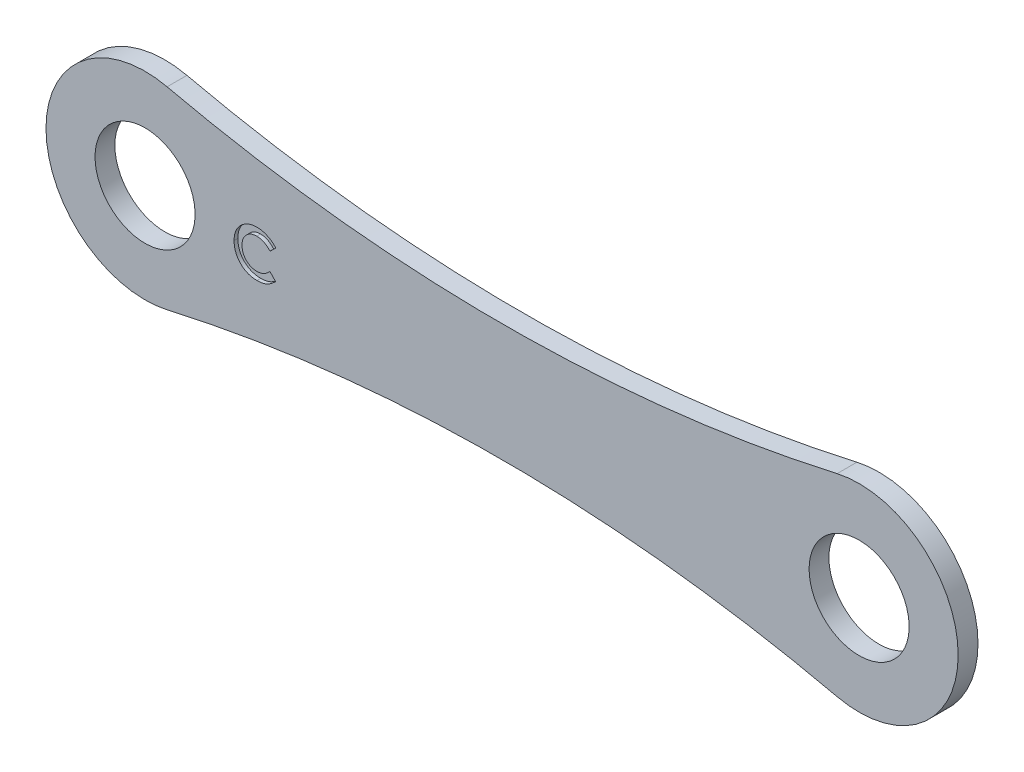
from build123d import *

# Parameters (mm, degrees)
ESQUISSE1_R             = 3.985
BOSS_EXTRU_1_DEPTH      = 1.58
ENL_V_MAT_EXTRU_1_DEPTH = 0.3


with BuildPart() as part:
    # Esquisse1 → Boss.-Extru.1 (new body)
    with BuildSketch(Plane(origin=(0, 0, 0), x_dir=(0, 1, 0), z_dir=(0, 0, 1))):
        with BuildLine():
            ThreePointArc((-7.69243745, 1.754567206), (0, -7.89), (7.69243745, 1.754567206))
            ThreePointArc((7.69243745, 1.754567206), (4.687683834, 28.44), (7.69243745, 55.125432794))
            ThreePointArc((7.69243745, 55.125432794), (0, 64.77), (-7.69243745, 55.125432794))
            ThreePointArc((-7.69243745, 55.125432794), (-4.687683834, 28.44), (-7.69243745, 1.754567206))
        make_face()
        with Locations(Location((0, 0, 0), (0, 0, 90))):
            Circle(ESQUISSE1_R, mode=Mode.SUBTRACT)
        with Locations(Location((0, 56.88, 0), (0, 0, 90))):
            Circle(ESQUISSE1_R, mode=Mode.SUBTRACT)
    extrude(amount=BOSS_EXTRU_1_DEPTH)

    # Esquisse2 → Enlèv. mat.-Extru.1 (cut)
    with BuildSketch(Plane.XY.offset(1.58)):
        with BuildLine():
            Line((-46.465889749, 0.892630637), (-46.926526768, 0.45232615))
            add(Edge.make_bspline(
                [(-46.926526768, 0.45232615), (-46.965601753, 0.49272975), (-47.04192744, 0.571650638), (-47.164916845, 0.676134939), (-47.292821348, 0.763208466), (-47.423152822, 0.836541237), (-47.558255553, 0.892022704), (-47.696567385, 0.932452984), (-47.838971481, 0.957101797), (-47.935345095, 0.959922058), (-47.983818435, 0.961340573)],
                knots=[0, 0, 0, 0, 1.115251505, 2.178435587, 3.19620269, 4.182487026, 5.141301733, 6.088180966, 7.038406374, 8, 8, 8, 8], degree=3))
            add(Edge.make_bspline(
                [(-47.983818435, 0.961340573), (-48.024299564, 0.960219896), (-48.104184612, 0.958008364), (-48.221476797, 0.941795654), (-48.333672834, 0.914225235), (-48.441156787, 0.87622809), (-48.543612381, 0.827061802), (-48.641254426, 0.766764423), (-48.73384219, 0.695880524), (-48.820152642, 0.614776863), (-48.89910641, 0.526165019), (-48.968867091, 0.431616392), (-49.027302852, 0.331347589), (-49.075260131, 0.226374058), (-49.112616997, 0.11620993), (-49.139294493, 0.000929371), (-49.154724043, -0.119604909), (-49.157027007, -0.201543214), (-49.158197441, -0.243186671)],
                knots=[0, 0, 0, 0, 1.035432265, 2.043311493, 3.022114605, 3.98653278, 4.95457646, 5.923598177, 6.917315552, 7.932509744, 8.948865224, 9.949768934, 10.933144597, 11.912367597, 12.897413939, 13.903909035, 14.934704909, 16, 16, 16, 16], degree=3))
            add(Edge.make_bspline(
                [(-49.158197441, -0.243186671), (-49.157860135, -0.272414963), (-49.157195299, -0.330024526), (-49.149917488, -0.41524506), (-49.138198495, -0.497929125), (-49.12123821, -0.577951477), (-49.100029206, -0.655381463), (-49.075146216, -0.730887069), (-49.04393087, -0.803424977), (-49.009281366, -0.873837667), (-48.968984392, -0.940203842), (-48.925536819, -1.003489497), (-48.878425021, -1.063384413), (-48.82734385, -1.119643738), (-48.771574403, -1.171388264), (-48.712558114, -1.220174011), (-48.64929946, -1.264779706), (-48.583112483, -1.306324779), (-48.513425411, -1.342415337), (-48.442129016, -1.37510641), (-48.368142301, -1.401656422), (-48.292366099, -1.423058153), (-48.215071208, -1.44125713), (-48.13550161, -1.452462799), (-48.054347076, -1.460948721), (-47.999500233, -1.461472677), (-47.971899364, -1.46173635)],
                knots=[0, 0, 0, 0, 1.103660481, 2.175337485, 3.227646561, 4.255952547, 5.262355991, 6.258840057, 7.255597736, 8.242457506, 9.22035537, 10.185017736, 11.140346927, 12.096287581, 13.051739095, 14.01125915, 14.986044842, 15.97314143, 16.960198552, 17.947847494, 18.933482797, 19.925264591, 20.920966487, 21.929612487, 22.958107872, 24, 24, 24, 24], degree=3))
            add(Edge.make_bspline(
                [(-47.971899364, -1.46173635), (-47.925083547, -1.460382188), (-47.833102641, -1.457721612), (-47.698107435, -1.436916285), (-47.569470453, -1.4026927), (-47.46669012, -1.362276634), (-47.386164443, -1.322365244), (-47.324861437, -1.285449174), (-47.261469349, -1.244154496), (-47.197041071, -1.196922705), (-47.130851909, -1.144320601), (-47.064070258, -1.0851961), (-46.994986493, -1.021496087), (-46.949730403, -0.976032136), (-46.926526768, -0.952721927)],
                knots=[0, 0, 0, 0, 1.404581149, 2.759636711, 4.088442092, 5.392261763, 6.066678138, 6.783632037, 7.538459478, 8.336747902, 9.180226004, 10.074962426, 11.012997595, 12, 12, 12, 12], degree=3))
            Line((-46.926526768, -0.952721927), (-46.479912185, -1.421772408))
            add(Edge.make_bspline(
                [(-46.479912185, -1.421772408), (-46.511306786, -1.45208291), (-46.572582334, -1.511242527), (-46.665014796, -1.595243664), (-46.757330929, -1.670728023), (-46.847300567, -1.740435357), (-46.936397505, -1.80233492), (-47.024612296, -1.856488534), (-47.11094631, -1.90426582), (-47.197192299, -1.94486104), (-47.283886932, -1.979330597), (-47.373085521, -2.009006624), (-47.465060755, -2.034111475), (-47.560374377, -2.054367792), (-47.658137358, -2.070610624), (-47.759264632, -2.081574442), (-47.863115, -2.088945052), (-47.933558314, -2.089607362), (-47.969094877, -2.089941478)],
                knots=[0, 0, 0, 0, 1.244526981, 2.429050516, 3.560637417, 4.644440555, 5.67424972, 6.652764056, 7.595344123, 8.486817594, 9.369275933, 10.254498637, 11.166417451, 12.086725134, 13.032340136, 13.991389299, 14.986715468, 16, 16, 16, 16], degree=3))
            add(Edge.make_bspline(
                [(-47.969094877, -2.089941478), (-48.034371141, -2.088277456), (-48.162098645, -2.085021427), (-48.349279971, -2.060896459), (-48.527097207, -2.020451373), (-48.695982948, -1.963250867), (-48.855883492, -1.890179901), (-49.006757933, -1.800598328), (-49.148363093, -1.694744151), (-49.279555082, -1.573858086), (-49.39822448, -1.440349574), (-49.503114485, -1.29699806), (-49.589879501, -1.143099023), (-49.661922363, -0.980926042), (-49.718258934, -0.809739061), (-49.75791033, -0.629352906), (-49.782363056, -0.439941752), (-49.785038219, -0.310569568), (-49.786402569, -0.244588914)],
                knots=[0, 0, 0, 0, 1.078019885, 2.10938526, 3.111377082, 4.085535484, 5.04941344, 6.010039228, 6.978205633, 7.964457913, 8.951525778, 9.924444315, 10.892603023, 11.863865945, 12.85144698, 13.863884204, 14.910567087, 16, 16, 16, 16], degree=3))
            add(Edge.make_bspline(
                [(-49.786402569, -0.244588914), (-49.785826061, -0.201556895), (-49.784683562, -0.11627795), (-49.772675795, 0.009344844), (-49.755936269, 0.131804598), (-49.729380533, 0.249829774), (-49.697370213, 0.365010388), (-49.657561174, 0.476094562), (-49.610016997, 0.583401563), (-49.556270142, 0.687111029), (-49.495466864, 0.786543551), (-49.427542926, 0.880844849), (-49.354246958, 0.97074291), (-49.273817774, 1.05504507), (-49.187424118, 1.134491518), (-49.094675932, 1.20865172), (-48.99613105, 1.278589214), (-48.891522746, 1.342500485), (-48.782883283, 1.400311626), (-48.671582889, 1.451303521), (-48.557895017, 1.493921003), (-48.442300349, 1.529270632), (-48.324310499, 1.555656631), (-48.204767649, 1.57562998), (-48.082654633, 1.586795211), (-48.000666322, 1.58862303), (-47.959279172, 1.589545701)],
                knots=[0, 0, 0, 0, 1.071919942, 2.124283339, 3.142214191, 4.149696895, 5.136002878, 6.119640489, 7.086990633, 8.058538607, 9.028339693, 9.988281803, 10.952401235, 11.916291999, 12.888973767, 13.874849856, 14.873389453, 15.898127285, 16.927174885, 17.938320013, 18.946391617, 19.950418109, 20.947802303, 21.956882652, 22.968648068, 24, 24, 24, 24], degree=3))
            add(Edge.make_bspline(
                [(-47.959279172, 1.589545701), (-47.92397169, 1.589016803), (-47.853723825, 1.587964506), (-47.749112966, 1.579192466), (-47.645338735, 1.565416065), (-47.542772677, 1.54463041), (-47.440681134, 1.51995521), (-47.340405703, 1.487646441), (-47.240364486, 1.451632228), (-47.142126479, 1.408584591), (-47.045554557, 1.361594206), (-46.95291107, 1.308281908), (-46.862640542, 1.251928476), (-46.776743314, 1.189198667), (-46.693610345, 1.122367809), (-46.613676346, 1.051124096), (-46.537642783, 0.974279688), (-46.489928341, 0.919984577), (-46.465889749, 0.892630637)],
                knots=[0, 0, 0, 0, 0.996412454, 1.982464992, 2.961075852, 3.949442424, 4.934965278, 5.923860011, 6.921385422, 7.934793307, 8.949617135, 9.951082467, 10.950285876, 11.951772932, 12.951063433, 13.960125323, 14.972308753, 16, 16, 16, 16], degree=3))
        make_face()
    extrude(amount=-ENL_V_MAT_EXTRU_1_DEPTH, mode=Mode.SUBTRACT)


solid = part.part
